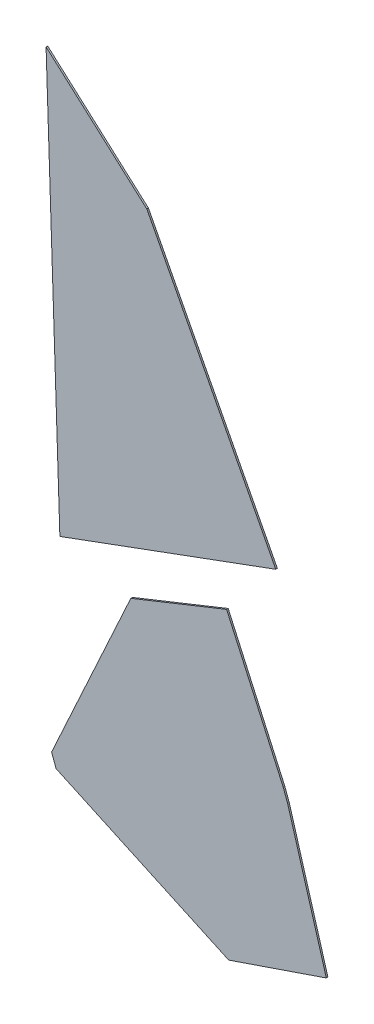
from build123d import *

# Parameters (mm, degrees)
BOSS_EXTRUDE1_DEPTH = 0.25
BOSS_EXTRUDE2_DEPTH = 0.25
BOSS_EXTRUDE3_DEPTH = 0.25


with BuildPart() as part:
    # Sketch3 → Boss-Extrude1 (new body)
    with BuildSketch(Plane.XY):
        Polygon((24.389305686, 16.429878113), (57.746622867, 28.713125646), (37.822366733, 66.963931479), (22.25679364, 80.865529077), align=None)
    extrude(amount=BOSS_EXTRUDE1_DEPTH)


with BuildPart() as body_2:
    # Sketch6 → Boss-Extrude2 (new body)
    with BuildSketch(Plane.XY):
        Polygon((23.107487467, -13.060957638), (58.876213079, 0.181757913), (50.146145837, 19.544800291), (35.348767399, 13.627878274), align=None)
    extrude(amount=BOSS_EXTRUDE2_DEPTH)

    # Sketch7 → Boss-Extrude3 (add)
    with BuildSketch(Plane.XY.offset(0.25)):
        Polygon((23.107487467, -13.060957638), (23.454687451, -13.998748751), (59.223413063, -0.7560332), (58.876213079, 0.181757913), align=None)
    extrude(amount=-BOSS_EXTRUDE3_DEPTH)

    # Mirror1: body 2 across plane


with BuildPart() as body_2_1:
    add(body_2.part)
    add(body_2.part.mirror(Plane(origin=(23.454687451, -13.998748751, -38.800088285), x_dir=(0, 0, 1), z_dir=(0.34719998380497613, -0.9377911127995532, 0))))


solid = Compound([part.part, body_2_1.part])
